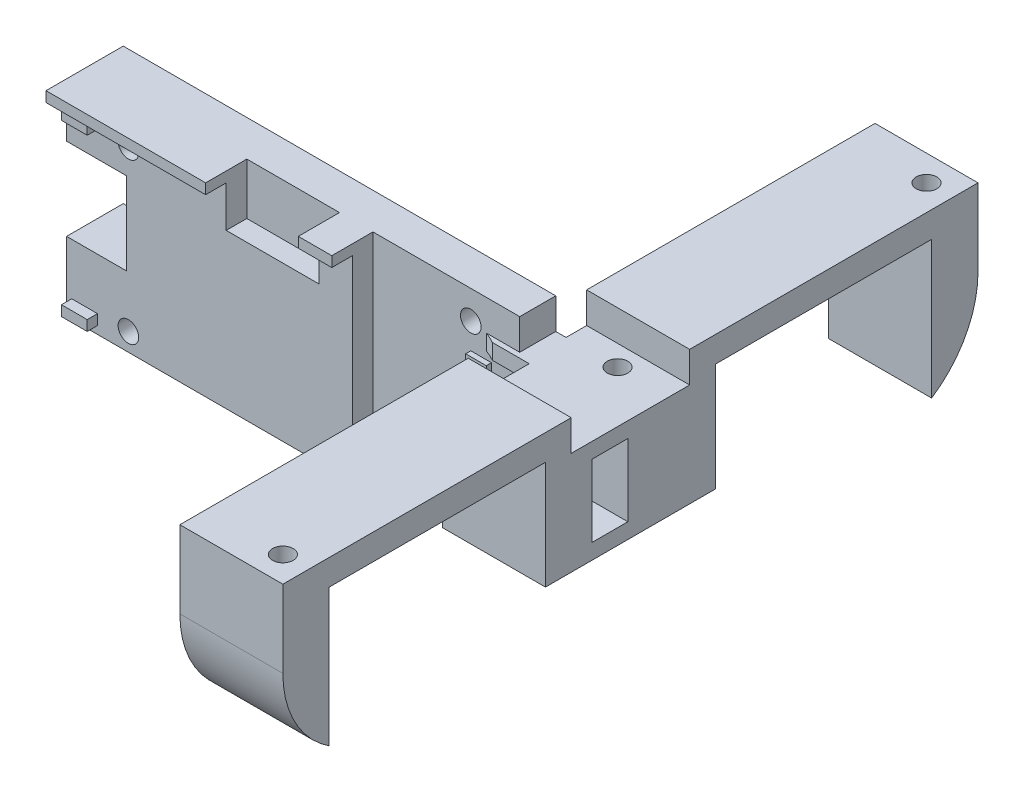
from build123d import *
from build123d.topology import SkipClean

# Parameters (mm, degrees)
BOSS_EXTRUDE1_DEPTH      = 35
CUT_EXTRUDE1_REACH       = 164.604
SKETCH2_W                = 42
SKETCH2_H                = 21
SKETCH3_R                = 2
CUT_EXTRUDE2_DEPTH       = 10
FILLET1_R                = 20
CUT_EXTRUDE5_REACH       = 164.604
SKETCH6_W                = 42
SKETCH6_H                = 9
CUT_EXTRUDE7_DEPTH       = 9
SKETCH9_R                = 2
CUT_EXTRUDE8_DEPTH       = 10
CUT_EXTRUDE9_DEPTH       = 6
SKETCH11_R               = 2
CUT_EXTRUDE10_DEPTH      = 9
SKETCH12_R               = 2
CUT_EXTRUDE11_DEPTH      = 10
SKETCH14_W               = 85
SKETCH14_H               = 33
CUT_EXTRUDE13_DEPTH      = 4
SKETCH15_W               = 28
SKETCH15_H               = 20
CUT_EXTRUDE14_DEPTH      = 4
BOSS_EXTRUDE2_DEPTH      = 5
BOSS_EXTRUDE2_DEPTH_BACK = 9
SKETCH16_W               = 80
SKETCH16_H               = 11
SKETCH13_R               = 2
CUT_EXTRUDE12_DEPTH      = 12
FILLET2_R                = 2
SKETCH17_W               = 28.5
SKETCH17_H               = 40
SKETCH17_W_2             = 18
SKETCH17_H_2             = 10
CUT_EXTRUDE15_DEPTH      = 8
CUT_EXTRUDE18_REACH      = 104.86
SKETCH20_W               = 8
SKETCH20_H               = 16
SKETCH7_R                = 2
CUT_EXTRUDE6_DEPTH       = 13
CHAMFER1_SIZE            = 10
CHAMFER1_SIZE2           = 3.639702343
CUT_EXTRUDE19_REACH      = 164.604
SKETCH22_W               = 7
SKETCH22_H               = 14
BOSS_EXTRUDE4_REACH      = 141.461
BOSS_EXTRUDE5_START      = -3
BOSS_EXTRUDE5_DEPTH      = 3
CUT_EXTRUDE21_DEPTH      = 140.460664257
CUT_EXTRUDE22_REACH      = 141.461
SKETCH27_W               = 7.175165893
SKETCH27_H               = 5
SKETCH28_W               = 5
SKETCH28_H               = 2
BOSS_EXTRUDE6_DEPTH      = 2
SKETCH29_W               = 4
SKETCH29_H               = 8
BOSS_EXTRUDE7_DEPTH      = 1
SKETCH30_W               = 3
SKETCH30_H               = 7
BOSS_EXTRUDE8_DEPTH      = 2


with BuildPart() as part:
    # Sketch1 → Boss-Extrude1 (new body)
    with BuildSketch(Plane(origin=(0, 0, 0), x_dir=(1, 0, 0), z_dir=(0, 1, 0))):
        Polygon((-40.317617866, 43.23325062), (45.682382134, 43.23325062), (45.682382134, -16.76674938), (65.682382134, -16.76674938), (65.682382134, 118.23325062), (45.682382134, 118.23325062), (45.682382134, 58.23325062), (-40.317617866, 58.23325062), align=None)
    extrude(amount=BOSS_EXTRUDE1_DEPTH)

    # Sketch2 → Cut-Extrude1 (cut, up to next)
    with BuildSketch(Plane(origin=(65.682382134, 0, 0), x_dir=(0, 0, -1), z_dir=(1, 0, 0)), mode=Mode.PRIVATE) as cut_extrude1_sk1:
        with Locations((13.23325062, 19.5)):
            Rectangle(SKETCH2_W, SKETCH2_H)
    cut_extrude1_tool1 = extrude(cut_extrude1_sk1.sketch, amount=-CUT_EXTRUDE1_REACH, mode=Mode.PRIVATE) & part.part
    # Sketch2 → Cut-Extrude1 (cut, up to next)
    with BuildSketch(Plane(origin=(65.682382134, 0, 0), x_dir=(0, 0, -1), z_dir=(1, 0, 0)), mode=Mode.PRIVATE) as cut_extrude1_sk2:
        with Locations((88.23325062, 19.5)):
            Rectangle(SKETCH2_W, SKETCH2_H)
    cut_extrude1_tool2 = extrude(cut_extrude1_sk2.sketch, amount=-CUT_EXTRUDE1_REACH, mode=Mode.PRIVATE) & part.part
    add(cut_extrude1_tool1.solids().sort_by_distance((65.682382, 19.5, -13.233251))[0], mode=Mode.SUBTRACT)
    add(cut_extrude1_tool2.solids().sort_by_distance((65.682382, 19.5, -88.233251))[0], mode=Mode.SUBTRACT)

    # Sketch3 → Cut-Extrude2 (cut)
    with BuildSketch(Plane.ZY.offset(-45.682382134)):
        with Locations((11.26674938, 24.75)):
            Circle(SKETCH3_R)
        with Locations((11.26674938, 15.25)):
            Circle(SKETCH3_R)
        with Locations((-37.73325062, 24.75)):
            Circle(SKETCH3_R)
        with Locations((-37.73325062, 15.25)):
            Circle(SKETCH3_R)
        with Locations(Location((-112.73325062, 24.75, 0), (0, 0, 180))):
            Circle(SKETCH3_R)
        with Locations(Location((-112.73325062, 15.25, 0), (0, 0, 180))):
            Circle(SKETCH3_R)
        with Locations(Location((-63.73325062, 15.25, 0), (0, 0, 180))):
            Circle(SKETCH3_R)
        with Locations(Location((-63.73325062, 24.75, 0), (0, 0, 180))):
            Circle(SKETCH3_R)
    extrude(amount=-CUT_EXTRUDE2_DEPTH, mode=Mode.SUBTRACT)

    # Fillet1
    fillet1_edges = [part.edges().sort_by_distance(p)[0] for p in [
        (55.682382134, 0, -118.23325062),
        (55.682382134, 0, 16.76674938),
    ]]
    fillet(fillet1_edges, radius=FILLET1_R)

    # Sketch6 → Cut-Extrude5 (cut, up to next)
    with BuildSketch(Plane(origin=(65.682382134, 0, 0), x_dir=(0, 0, -1), z_dir=(1, 0, 0)), mode=Mode.PRIVATE) as cut_extrude5_sk1:
        with Locations((13.23325062, 4.5)):
            Rectangle(SKETCH6_W, SKETCH6_H)
    cut_extrude5_tool1 = extrude(cut_extrude5_sk1.sketch, amount=-CUT_EXTRUDE5_REACH, mode=Mode.PRIVATE) & part.part
    # Sketch6 → Cut-Extrude5 (cut, up to next)
    with BuildSketch(Plane(origin=(65.682382134, 0, 0), x_dir=(0, 0, -1), z_dir=(1, 0, 0)), mode=Mode.PRIVATE) as cut_extrude5_sk2:
        with Locations((88.23325062, 4.5)):
            Rectangle(SKETCH6_W, SKETCH6_H)
    cut_extrude5_tool2 = extrude(cut_extrude5_sk2.sketch, amount=-CUT_EXTRUDE5_REACH, mode=Mode.PRIVATE) & part.part
    add(cut_extrude5_tool1.solids().sort_by_distance((65.682382, 4.5, -13.233251))[0], mode=Mode.SUBTRACT)
    add(cut_extrude5_tool2.solids().sort_by_distance((65.682382, 4.5, -88.233251))[0], mode=Mode.SUBTRACT)

    # Sketch8 → Cut-Extrude7 (cut)
    with BuildSketch(Plane.XZ):
        Polygon((45.682382134, -67.23325062), (45.682382134, -58.23325062), (25.682382134, -58.23325062), (25.682382134, -43.23325062), (45.682382134, -43.23325062), (45.682382134, -34.23325062), (65.682382134, -34.23325062), (65.682382134, -67.23325062), align=None)
    extrude(amount=-CUT_EXTRUDE7_DEPTH, mode=Mode.SUBTRACT)

    # Sketch9 → Cut-Extrude8 (cut)
    with BuildSketch(Plane.XZ.offset(-9)):
        with Locations(Location((55.682382134, -42.23325062, 0), (0, 0, 270))):
            Circle(SKETCH9_R)
        with Locations(Location((55.682382134, -59.23325062, 0), (0, 0, 270))):
            Circle(SKETCH9_R)
    extrude(amount=-CUT_EXTRUDE8_DEPTH, mode=Mode.SUBTRACT)

    # Sketch10 → Cut-Extrude9 (cut)
    with BuildSketch(Plane(origin=(0, 35, 0), x_dir=(1, 0, 0), z_dir=(0, 1, 0))):
        Polygon((45.682382134, 62.23325062), (65.682382134, 62.23325062), (65.682382134, 39.23325062), (45.682382134, 39.23325062), (45.682382134, 43.23325062), (43.682382134, 43.23325062), (43.682382134, 58.23325062), (45.682382134, 58.23325062), align=None)
    extrude(amount=-CUT_EXTRUDE9_DEPTH, mode=Mode.SUBTRACT)

    # Sketch11 → Cut-Extrude10 (cut)
    with BuildSketch(Plane(origin=(0, 29, 0), x_dir=(1, 0, 0), z_dir=(0, 1, 0))):
        with Locations(Location((55.682382134, 58.23325062, 0), (0, 0, 270))):
            Circle(SKETCH11_R)
        with Locations(Location((55.682382134, 43.23325062, 0), (0, 0, 270))):
            Circle(SKETCH11_R)
    extrude(amount=-CUT_EXTRUDE10_DEPTH, mode=Mode.SUBTRACT)

    # Sketch12 → Cut-Extrude11 (cut)
    with BuildSketch(Plane(origin=(0, 35, 0), x_dir=(1, 0, 0), z_dir=(0, 1, 0))):
        with Locations(Location((60.682382134, -11.76674938, 0), (0, 0, 270))):
            Circle(SKETCH12_R)
        with Locations(Location((60.682382134, 113.23325062, 0), (0, 0, 270))):
            Circle(SKETCH12_R)
    extrude(amount=-CUT_EXTRUDE11_DEPTH, mode=Mode.SUBTRACT)

    # Sketch14 → Cut-Extrude13 (cut)
    with BuildSketch(Plane.XY.offset(-43.23325062)):
        with Locations((2.182382134, 16.5)):
            Rectangle(SKETCH14_W, SKETCH14_H)
    extrude(amount=-CUT_EXTRUDE13_DEPTH, mode=Mode.SUBTRACT)

    # Sketch15 → Cut-Extrude14 (cut)
    with BuildSketch(Plane.XY.offset(-47.23325062)):
        with Locations((29.682382134, 10)):
            Rectangle(SKETCH15_W, SKETCH15_H)
    extrude(amount=-CUT_EXTRUDE14_DEPTH, mode=Mode.SUBTRACT)

    # Sketch16 → Boss-Extrude2 (add, two sides: drawn at the far end of the back side and taken through both)
    with BuildSketch(Plane.XZ.offset(-BOSS_EXTRUDE2_DEPTH_BACK)):
        with Locations((-0.317617866, -52.73325062)):
            Rectangle(SKETCH16_W, SKETCH16_H)
    extrude(amount=BOSS_EXTRUDE2_DEPTH + BOSS_EXTRUDE2_DEPTH_BACK)

    # Sketch13 → Cut-Extrude12 (cut)
    with BuildSketch(Plane.XY.offset(-43.23325062)):
        with Locations((-28.317617866, 29.5)):
            Circle(SKETCH13_R)
        with Locations((34.182382134, 29.5)):
            Circle(SKETCH13_R)
        with Locations((34.182382134, -1.5)):
            Circle(SKETCH13_R)
        with Locations((-28.317617866, -1.5)):
            Circle(SKETCH13_R)
    extrude(amount=-CUT_EXTRUDE12_DEPTH, mode=Mode.SUBTRACT)

    # Fillet2
    fillet2_edges = [part.edges().sort_by_distance(p)[0] for p in [
        (39.682382134, -5, -52.73325062),
    ]]
    fillet(fillet2_edges, radius=FILLET2_R)

    # Sketch17 → Cut-Extrude15 (cut)
    with BuildSketch(Plane.XY.offset(-43.23325062)):
        with Locations((29.432382134, 15)):
            Rectangle(SKETCH17_W, SKETCH17_H)
        with Locations((-0.317617866, 30)):
            Rectangle(SKETCH17_W_2, SKETCH17_H_2)
    extrude(amount=-CUT_EXTRUDE15_DEPTH, mode=Mode.SUBTRACT)

    # Sketch20 → Cut-Extrude18 (cut, up to next)
    with BuildSketch(Plane.XY.offset(-47.23325062), mode=Mode.PRIVATE) as cut_extrude18_sk1:
        with Locations((-36.317617866, 16.5)):
            Rectangle(SKETCH20_W, SKETCH20_H)
    cut_extrude18_tool1 = extrude(cut_extrude18_sk1.sketch, amount=-CUT_EXTRUDE18_REACH, mode=Mode.PRIVATE) & part.part
    add(cut_extrude18_tool1.solids().sort_by_distance((-36.317618, 16.5, -47.233251))[0], mode=Mode.SUBTRACT)

    # Sketch7 → Cut-Extrude6 (cut)
    with BuildSketch(Plane.ZY.offset(40.317617866)):
        with Locations((-50.73325062, 28.5)):
            Circle(SKETCH7_R)
        with Locations((-50.73325062, 5)):
            Circle(SKETCH7_R)
    extrude(amount=-CUT_EXTRUDE6_DEPTH, mode=Mode.SUBTRACT)

    # Chamfer1
    chamfer1_edges = [part.edges().sort_by_distance(p)[0] for p in [
        (-32.317617866, 16.5, -47.23325062),
    ]]
    chamfer1_side = [part.faces().sort_by_distance(p)[0] for p in [
        (-32.317617866, 16.5, -52.73325062),
    ]]
    chamfer(chamfer1_edges, length=CHAMFER1_SIZE, length2=CHAMFER1_SIZE2, reference=chamfer1_side[0])

    # Sketch22 → Cut-Extrude19 (cut, up to next)
    with BuildSketch(Plane(origin=(65.682382134, 0, 0), x_dir=(0, 0, -1), z_dir=(1, 0, 0)), mode=Mode.PRIVATE) as cut_extrude19_sk1:
        with Locations((46.73325062, 19)):
            Rectangle(SKETCH22_W, SKETCH22_H)
    cut_extrude19_tool1 = extrude(cut_extrude19_sk1.sketch, amount=-CUT_EXTRUDE19_REACH, mode=Mode.PRIVATE) & part.part
    add(cut_extrude19_tool1.solids().sort_by_distance((65.682382, 19, -46.733251))[0], mode=Mode.SUBTRACT)

    # Boss-Extrude4: up to this face of the body (flat: up to its plane)
    boss_extrude4_end = Plane(part.part.faces().sort_by_distance((54.930904304, 26, -46.8909066))[0])
    # Sketch24 → Boss-Extrude4 (add, up to the picked face)
    with BuildSketch(Plane(origin=(0, 29, 0), x_dir=(1, 0, 0), z_dir=(0, 1, 0)), mode=Mode.PRIVATE) as boss_extrude4_sk1:
        with BuildLine():
            Line((37.182382134, 51.23325062), (45.682382134, 51.23325062))
            Line((45.682382134, 51.23325062), (45.682382134, 39.23325062))
            ThreePointArc((45.682382134, 39.23325062), (43.342105313, 46.585971205), (37.182382134, 51.23325062))
        make_face()
    boss_extrude4_tool1 = split(extrude(boss_extrude4_sk1.sketch, amount=-BOSS_EXTRUDE4_REACH, mode=Mode.PRIVATE), bisect_by=boss_extrude4_end, keep=Keep.BOTH, mode=Mode.PRIVATE)
    add(boss_extrude4_tool1.solids().sort_by(Axis((43.397163, 29, -48.466484), (0, -1, 0)))[0])

    # Sketch25 → Boss-Extrude5 (add)
    with BuildSketch(Plane.XZ.offset(-9).offset(BOSS_EXTRUDE5_START)):
        with BuildLine():
            Line((37.182382134, -51.23325062), (45.682382134, -51.23325062))
            Line((45.682382134, -51.23325062), (45.682382134, -39.23325062))
            ThreePointArc((45.682382134, -39.23325062), (43.342105313, -46.585971205), (37.182382134, -51.23325062))
        make_face()
    extrude(amount=BOSS_EXTRUDE5_DEPTH)

    # Sketch26 → Cut-Extrude21 (cut, through all)
    with BuildSketch(Plane(origin=(0, 29, 0), x_dir=(1, 0, 0), z_dir=(0, 1, 0))):
        with BuildLine():
            Line((45.239754001, 42.559669232), (43.686053775, 42.559669232))
            Line((43.686053775, 42.559669232), (44.063234426, 45.443837008))
            ThreePointArc((44.063234426, 45.443837008), (44.740108693, 44.037901041), (45.239754001, 42.559669232))
        make_face()
    extrude(amount=-CUT_EXTRUDE21_DEPTH, mode=Mode.SUBTRACT)

    # Sketch27 → Cut-Extrude22 (cut, up to next)
    with BuildSketch(Plane(origin=(0, 29, 0), x_dir=(1, 0, 0), z_dir=(0, 1, 0)), mode=Mode.PRIVATE) as cut_extrude22_sk1:
        with Locations((42.937910719, 47.73325062)):
            Rectangle(SKETCH27_W, SKETCH27_H)
    cut_extrude22_tool1 = extrude(cut_extrude22_sk1.sketch, amount=-CUT_EXTRUDE22_REACH, mode=Mode.PRIVATE) & part.part
    add(cut_extrude22_tool1.solids().sort_by_distance((42.937911, 29, -47.733251))[0], mode=Mode.SUBTRACT)

    # Sketch28 → Boss-Extrude6 (add)
    with SkipClean():  # the faces are left unmerged after this step: merging them gives an invalid solid
        with BuildSketch(Plane.XY.offset(-47.23325062)):
            with Locations((-36.817617866, 30.5)):
                Rectangle(SKETCH28_W, SKETCH28_H)
            with Locations((-36.817617866, -2.5)):
                Rectangle(SKETCH28_W, SKETCH28_H)
        extrude(amount=BOSS_EXTRUDE6_DEPTH)

    # Sketch29 → Boss-Extrude7 (add)
    with SkipClean():  # the faces are left unmerged after this step: merging them gives an invalid solid
        with BuildSketch(Plane.XY.offset(-51.23325062)):
            with Locations((36.182382134, 20.5)):
                Rectangle(SKETCH29_W, SKETCH29_H)
        extrude(amount=BOSS_EXTRUDE7_DEPTH)

    # Sketch30 → Boss-Extrude8 (add)
    with SkipClean():  # the faces are left unmerged after this step: merging them gives an invalid solid
        with BuildSketch(Plane.XY.offset(-51.23325062)):
            with Locations((35.182382134, 8)):
                Rectangle(SKETCH30_W, SKETCH30_H)
        extrude(amount=BOSS_EXTRUDE8_DEPTH)


solid = part.part
